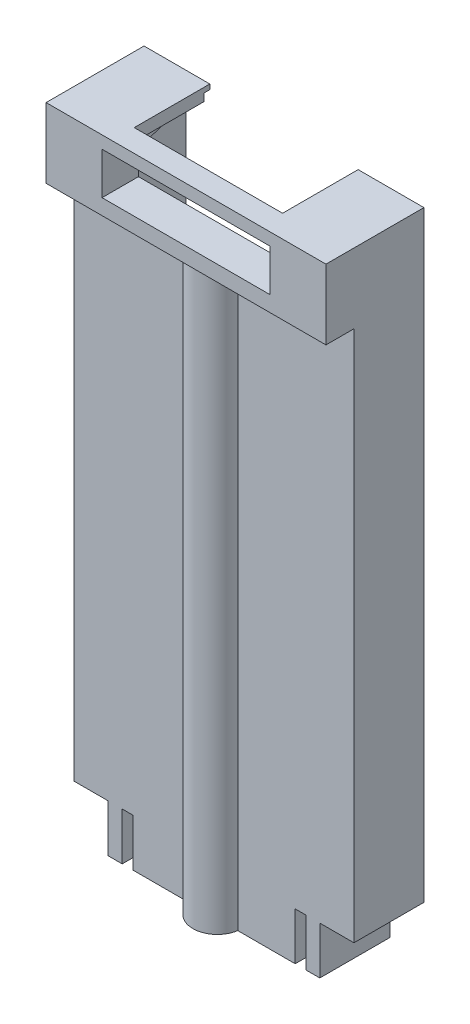
from build123d import *

# Parameters (mm, degrees)
SKETCH2_W            = 20
SKETCH2_H            = 43
BOSS_EXTRUDE1_DEPTH  = 5
SKETCH3_W            = 20
SKETCH3_H            = 5
BOSS_EXTRUDE2_DEPTH  = 2
SKETCH4_W            = 1
SKETCH4_H            = 5
BOSS_EXTRUDE4_DEPTH  = 3.4
SKETCH6_W            = 11.6
SKETCH6_H            = 5
BOSS_EXTRUDE5_DEPTH  = 3.4
SKETCH8_W            = 12.4
SKETCH8_H            = 3.6
CUT_EXTRUDE1_DEPTH   = 52.009410896
BOSS_EXTRUDE6_DEPTH  = 41.4
SKETCH10_R           = 1.2
CUT_EXTRUDE2_DEPTH   = 41.4
SKETCH12_W           = 2.4
SKETCH12_H           = 1.123326967
CUT_EXTRUDE3_DEPTH   = 41.4
SKETCH14_W           = 12
SKETCH14_H           = 3
CUT_EXTRUDE5_DEPTH   = 3.4
SKETCH15_W           = 3.6
SKETCH15_H           = 43
CUT_EXTRUDE6_DEPTH   = 0.8
SKETCH16_W           = 3.6
SKETCH16_H           = 43
CUT_EXTRUDE7_DEPTH   = 0.8
SKETCH17_W           = 14
SKETCH17_H           = 43.036158128
CUT_EXTRUDE8_DEPTH   = 0.8
SKETCH18_W           = 4.4
SKETCH18_H           = 0.7
BOSS_EXTRUDE7_DEPTH  = 0.7
SKETCH19_W           = 4.4
SKETCH19_H           = 0.7
BOSS_EXTRUDE8_DEPTH  = 0.7
SKETCH21_W           = 4.4
SKETCH21_H           = 0.7
BOSS_EXTRUDE10_DEPTH = 1
SKETCH22_W           = 4.4
SKETCH22_H           = 0.7
BOSS_EXTRUDE11_DEPTH = 1
SKETCH23_W           = 1.7
SKETCH23_H           = 4.4
BOSS_EXTRUDE12_DEPTH = 2
CUT_EXTRUDE9_REACH   = 48.175
CUT_EXTRUDE10_REACH  = 48.175
CUT_EXTRUDE11_REACH  = 48.175
CUT_EXTRUDE12_REACH  = 48.175
CUT_EXTRUDE17_START  = -1.7
CUT_EXTRUDE17_DEPTH  = 1.7
CUT_EXTRUDE18_REACH  = 48.175
BOSS_EXTRUDE13_DEPTH = 41.4
SKETCH35_W           = 0.7
SKETCH35_H           = 1.29581549
SKETCH35_H_2         = 1.222235382
CUT_EXTRUDE19_DEPTH  = 10
CUT_EXTRUDE20_DEPTH  = 0.7
CUT_EXTRUDE21_DEPTH  = 0.7
SKETCH38_W           = 10.6
SKETCH38_H           = 0.887130053
CUT_EXTRUDE22_DEPTH  = 1


with BuildPart() as part:
    # Sketch2 → Boss-Extrude1 (new body)
    with BuildSketch(Plane.XY):
        with Locations((10, 21.5)):
            Rectangle(SKETCH2_W, SKETCH2_H)
    extrude(amount=BOSS_EXTRUDE1_DEPTH)

    # Sketch3 → Boss-Extrude2 (add)
    with BuildSketch(Plane.XY.offset(5)):
        with Locations((10, 40.5)):
            Rectangle(SKETCH3_W, SKETCH3_H)
    extrude(amount=BOSS_EXTRUDE2_DEPTH)

    # Sketch4 → Boss-Extrude4 (add)
    with BuildSketch(Plane.XZ):
        with Locations((2.94, 2.5)):
            Rectangle(SKETCH4_W, SKETCH4_H)
        with Locations((17.06, 2.5)):
            Rectangle(SKETCH4_W, SKETCH4_H)
    extrude(amount=BOSS_EXTRUDE4_DEPTH)

    # Sketch6 → Boss-Extrude5 (add)
    with BuildSketch(Plane.XZ):
        with Locations((10, 2.5)):
            Rectangle(SKETCH6_W, SKETCH6_H)
    extrude(amount=BOSS_EXTRUDE5_DEPTH)

    # Sketch8 → Cut-Extrude1 (cut, through all)
    with BuildSketch(Plane(origin=(0, 43, 0), x_dir=(1, 0, 0), z_dir=(0, 1, 0))):
        with Locations((10, -1.8)):
            Rectangle(SKETCH8_W, SKETCH8_H)
    extrude(amount=-CUT_EXTRUDE1_DEPTH, mode=Mode.SUBTRACT)

    # Sketch9 → Boss-Extrude6 (add)
    with BuildSketch(Plane.XZ.offset(3.4)):
        with BuildLine():
            Line((8.5, 5), (11.448526434, 5))
            ThreePointArc((11.448526434, 5), (9.974263217, 6.223326967), (8.5, 5))
        make_face()
    extrude(amount=-BOSS_EXTRUDE6_DEPTH)

    # Sketch10 → Cut-Extrude2 (cut)
    with BuildSketch(Plane.XZ.offset(3.4)):
        with Locations((9.974263217, 4.723326967)):
            Circle(SKETCH10_R)
    extrude(amount=-CUT_EXTRUDE2_DEPTH, mode=Mode.SUBTRACT)

    # Sketch12 → Cut-Extrude3 (cut)
    with BuildSketch(Plane.XZ.offset(3.4)):
        with Locations((9.974263217, 4.161663483)):
            Rectangle(SKETCH12_W, SKETCH12_H)
    extrude(amount=-CUT_EXTRUDE3_DEPTH, mode=Mode.SUBTRACT)

    # Sketch14 → Cut-Extrude5 (cut)
    with BuildSketch(Plane.XY.offset(7)):
        with Locations((10, 40.612869947)):
            Rectangle(SKETCH14_W, SKETCH14_H)
    extrude(amount=-CUT_EXTRUDE5_DEPTH, mode=Mode.SUBTRACT)

    # Sketch15 → Cut-Extrude6 (cut)
    with BuildSketch(Plane(origin=(3.8, 0, 0), x_dir=(0, 0, -1), z_dir=(1, 0, 0))):
        with Locations((-1.8, 21.5)):
            Rectangle(SKETCH15_W, SKETCH15_H)
    extrude(amount=-CUT_EXTRUDE6_DEPTH, mode=Mode.SUBTRACT)

    # Sketch16 → Cut-Extrude7 (cut)
    with BuildSketch(Plane.ZY.offset(-16.2)):
        with Locations((1.8, 21.5)):
            Rectangle(SKETCH16_W, SKETCH16_H)
    extrude(amount=-CUT_EXTRUDE7_DEPTH, mode=Mode.SUBTRACT)

    # Sketch17 → Cut-Extrude8 (cut)
    with BuildSketch(Plane(origin=(0, 0, 3.6), x_dir=(-1, 0, 0), z_dir=(0, 0, -1))):
        with Locations((-10, 21.481920936)):
            Rectangle(SKETCH17_W, SKETCH17_H)
    extrude(amount=-CUT_EXTRUDE8_DEPTH, mode=Mode.SUBTRACT)

    # Sketch18 → Boss-Extrude7 (add)
    with BuildSketch(Plane.ZY.offset(-17)):
        with Locations((2.2, 42.65)):
            Rectangle(SKETCH18_W, SKETCH18_H)
    extrude(amount=BOSS_EXTRUDE7_DEPTH)

    # Sketch19 → Boss-Extrude8 (add)
    with BuildSketch(Plane(origin=(3, 0, 0), x_dir=(0, 0, -1), z_dir=(1, 0, 0))):
        with Locations((-2.2, 42.65)):
            Rectangle(SKETCH19_W, SKETCH19_H)
    extrude(amount=BOSS_EXTRUDE8_DEPTH)

    # Sketch21 → Boss-Extrude10 (add)
    with BuildSketch(Plane(origin=(3.7, 0, 0), x_dir=(0, 0, -1), z_dir=(1, 0, 0))):
        with Locations((-2.2, 42.65)):
            Rectangle(SKETCH21_W, SKETCH21_H)
    extrude(amount=BOSS_EXTRUDE10_DEPTH)

    # Sketch22 → Boss-Extrude11 (add)
    with BuildSketch(Plane.ZY.offset(-16.3)):
        with Locations((2.2, 42.65)):
            Rectangle(SKETCH22_W, SKETCH22_H)
    extrude(amount=BOSS_EXTRUDE11_DEPTH)

    # Sketch23 → Boss-Extrude12 (add)
    with BuildSketch(Plane.XZ.offset(-42.3)):
        with Locations((16.15, 2.2)):
            Rectangle(SKETCH23_W, SKETCH23_H)
        with Locations((3.85, 2.2)):
            Rectangle(SKETCH23_W, SKETCH23_H)
    extrude(amount=BOSS_EXTRUDE12_DEPTH)

    # Cut-Extrude9: up to this face of the body (flat: up to its plane)
    cut_extrude9_end = Plane(part.part.faces().sort_by_distance((17, 20.146710485, 2.200293589))[0])
    # Sketch24 → Cut-Extrude9 (cut, up to the picked face)
    with BuildSketch(Plane.ZY.offset(-15.3), mode=Mode.PRIVATE) as cut_extrude9_sk1:
        Polygon((0, 40.3), (0, 41.65), (4.4, 40.3), align=None)
    cut_extrude9_tool1 = split(extrude(cut_extrude9_sk1.sketch, amount=-CUT_EXTRUDE9_REACH, mode=Mode.PRIVATE), bisect_by=cut_extrude9_end, keep=Keep.BOTH, mode=Mode.PRIVATE)
    add(cut_extrude9_tool1.solids().sort_by(Axis((15.3, 40.75, 1.466667), (1, 0, 0)))[0], mode=Mode.SUBTRACT)

    # Cut-Extrude10: up to this face of the body (flat: up to its plane)
    cut_extrude10_end = Plane(part.part.faces().sort_by_distance((17, 20.486063491, 2.188210154))[0])
    # Sketch25 → Cut-Extrude10 (cut, up to the picked face)
    with BuildSketch(Plane.ZY.offset(-15.3), mode=Mode.PRIVATE) as cut_extrude10_sk1:
        Polygon((0, 41.65), (0, 41.890531127), (0, 41.963142854), (4.4, 40.567054457), (4.4, 40.3), align=None)
    cut_extrude10_tool1 = split(extrude(cut_extrude10_sk1.sketch, amount=-CUT_EXTRUDE10_REACH, mode=Mode.PRIVATE), bisect_by=cut_extrude10_end, keep=Keep.BOTH, mode=Mode.PRIVATE)
    add(cut_extrude10_tool1.solids().sort_by(Axis((15.3, 41.138227, 2.141747), (1, 0, 0)))[0], mode=Mode.SUBTRACT)

    # Cut-Extrude11: up to this face of the body (flat: up to its plane)
    cut_extrude11_end = Plane(part.part.faces().sort_by_distance((3, 20.146710485, 2.200293589))[0])
    # Sketch26 → Cut-Extrude11 (cut, up to the picked face)
    with BuildSketch(Plane(origin=(4.7, 0, 0), x_dir=(0, 0, -1), z_dir=(1, 0, 0)), mode=Mode.PRIVATE) as cut_extrude11_sk1:
        Polygon((0, 40.3), (0, 41.65), (-4.4, 40.3), align=None)
    cut_extrude11_tool1 = split(extrude(cut_extrude11_sk1.sketch, amount=-CUT_EXTRUDE11_REACH, mode=Mode.PRIVATE), bisect_by=cut_extrude11_end, keep=Keep.BOTH, mode=Mode.PRIVATE)
    add(cut_extrude11_tool1.solids().sort_by(Axis((4.7, 40.75, 1.466667), (-1, 0, 0)))[0], mode=Mode.SUBTRACT)

    # Cut-Extrude12: up to this face of the body (flat: up to its plane)
    cut_extrude12_end = Plane(part.part.faces().sort_by_distance((3, 20.486063491, 2.188210154))[0])
    # Sketch27 → Cut-Extrude12 (cut, up to the picked face)
    with BuildSketch(Plane(origin=(4.7, 0, 0), x_dir=(0, 0, -1), z_dir=(1, 0, 0)), mode=Mode.PRIVATE) as cut_extrude12_sk1:
        Polygon((-4.4, 40.3), (-4.4, 40.64), (0, 41.99), (0, 41.65), align=None)
    cut_extrude12_tool1 = split(extrude(cut_extrude12_sk1.sketch, amount=-CUT_EXTRUDE12_REACH, mode=Mode.PRIVATE), bisect_by=cut_extrude12_end, keep=Keep.BOTH, mode=Mode.PRIVATE)
    add(cut_extrude12_tool1.solids().sort_by(Axis((4.7, 41.145, 2.2), (-1, 0, 0)))[0], mode=Mode.SUBTRACT)

    # Sketch32 → Cut-Extrude17 (cut)
    with BuildSketch(Plane(origin=(4.7, 0, 0), x_dir=(0, 0, -1), z_dir=(1, 0, 0)).offset(CUT_EXTRUDE17_START)):
        Polygon((-4.4, 40.64), (-4.4, 40.890634565), (0, 42.24), (0, 41.99), align=None)
    extrude(amount=CUT_EXTRUDE17_DEPTH, mode=Mode.SUBTRACT)

    # Cut-Extrude18: up to this face of the body (flat: up to its plane)
    cut_extrude18_end = Plane(part.part.faces().sort_by_distance((17, 20.631227586, 2.187883566))[0])
    # Sketch33 → Cut-Extrude18 (cut, up to the picked face)
    with BuildSketch(Plane.ZY.offset(-15.3), mode=Mode.PRIVATE) as cut_extrude18_sk1:
        Polygon((4.4, 40.567054457), (4.4, 40.817054457), (0, 42.213142854), (0, 41.963142854), align=None)
    cut_extrude18_tool1 = split(extrude(cut_extrude18_sk1.sketch, amount=-CUT_EXTRUDE18_REACH, mode=Mode.PRIVATE), bisect_by=cut_extrude18_end, keep=Keep.BOTH, mode=Mode.PRIVATE)
    add(cut_extrude18_tool1.solids().sort_by(Axis((15.3, 41.390099, 2.2), (1, 0, 0)))[0], mode=Mode.SUBTRACT)

    # Sketch34 → Boss-Extrude13 (add)
    with BuildSketch(Plane.XZ.offset(3.4)):
        with BuildLine():
            Line((8.5, 5), (8.25, 5))
            ThreePointArc((8.25, 5), (9.974263217, 6.480805911), (11.698526434, 5))
            Line((11.698526434, 5), (11.448526434, 5))
            ThreePointArc((11.448526434, 5), (9.974263217, 6.223326967), (8.5, 5))
        make_face()
    extrude(amount=-BOSS_EXTRUDE13_DEPTH)

    # Sketch35 → Cut-Extrude19 (cut)
    with BuildSketch(Plane.XY.offset(4.4)):
        with Locations((15.65, 41.464962202)):
            Rectangle(SKETCH35_W, SKETCH35_H)
        with Locations((4.35, 41.501752256)):
            Rectangle(SKETCH35_W, SKETCH35_H_2)
    extrude(amount=-CUT_EXTRUDE19_DEPTH, mode=Mode.SUBTRACT)

    # Sketch36 → Cut-Extrude20 (cut)
    with BuildSketch(Plane.ZY.offset(-15.3)):
        Polygon((0, 42.213142854), (0.316026403, 42.112869947), (0.663813881, 42.112869947), (0.663813881, 42.457397345), (0, 42.457397345), align=None)
    extrude(amount=-CUT_EXTRUDE20_DEPTH, mode=Mode.SUBTRACT)

    # Sketch37 → Cut-Extrude21 (cut)
    with BuildSketch(Plane(origin=(4.7, 0, 0), x_dir=(0, 0, -1), z_dir=(1, 0, 0))):
        Polygon((0, 42.24), (-0.41454466, 42.112869947), (-0.41454466, 42.646558134), (0, 42.646558134), align=None)
    extrude(amount=-CUT_EXTRUDE21_DEPTH, mode=Mode.SUBTRACT)

    # Sketch38 → Cut-Extrude22 (cut)
    with BuildSketch(Plane(origin=(0, 0, 4.4), x_dir=(-1, 0, 0), z_dir=(0, 0, -1))):
        with Locations((-10, 42.556434974)):
            Rectangle(SKETCH38_W, SKETCH38_H)
    extrude(amount=-CUT_EXTRUDE22_DEPTH, mode=Mode.SUBTRACT)


solid = part.part
